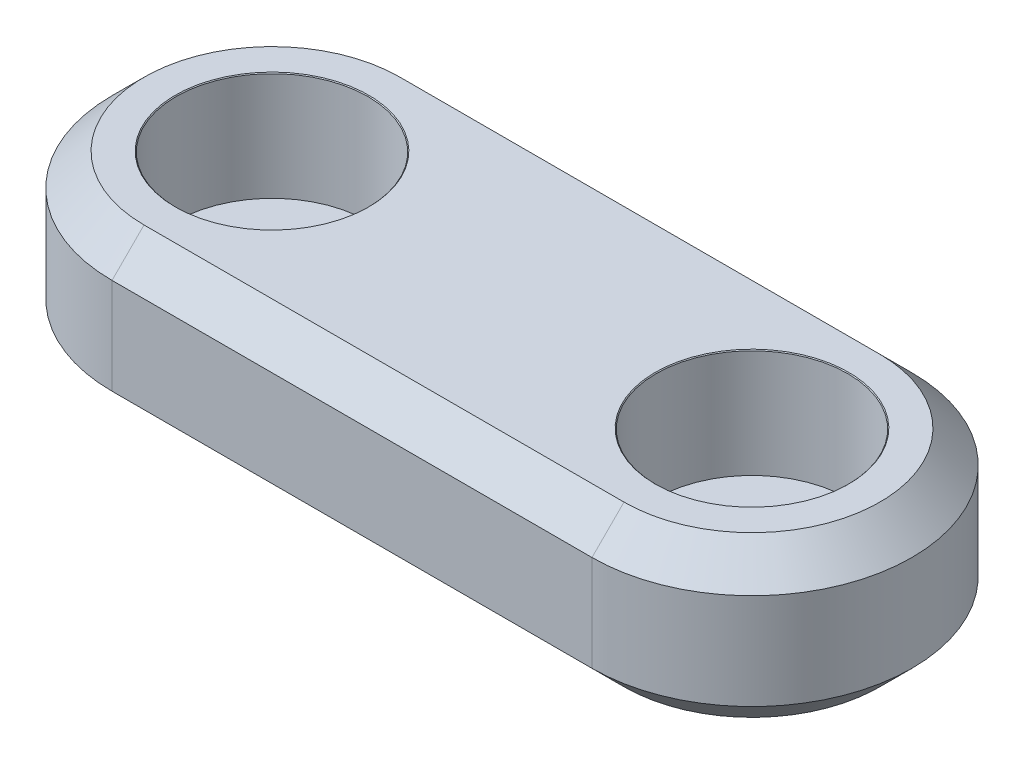
from build123d import *

# Parameters (mm, degrees)
BOSS_EXTRUDE1_DEPTH                          = 5
CBORE_FOR_M3_HEXAGON_SOCKET_HEAD_CAP_2_COUNT = 2
CBORE_FOR_M3_HEXAGON_SOCKET_HEAD_CAP_2_PITCH = 15
CHAMFER1_SIZE                                = 1


with BuildPart() as part:
    # Sketch1 → Boss-Extrude1 (new body)
    with BuildSketch(Plane(origin=(0, 0, 0), x_dir=(1, 0, 0), z_dir=(0, 1, 0))):
        with BuildLine():
            Line((-7.5, 5), (7.5, 5))
            ThreePointArc((7.5, 5), (12.5, 0), (7.5, -5))
            Line((7.5, -5), (-7.5, -5))
            ThreePointArc((-7.5, -5), (-12.5, 0), (-7.5, 5))
        make_face()
    extrude(amount=BOSS_EXTRUDE1_DEPTH)

    # Sketch3 → CBORE for M3 Hexagon socket head cap screws1 (revolve, cut)
    with BuildSketch(Plane(origin=(-7.5, 5, 0), x_dir=(0, 0, 1), z_dir=(1, 0, 0))):
        Polygon((0, 0), (0, 5), (1.6, 5), (1.6, 3.4), (3, 3.4), (3, 0.025), (3.025, 0), align=None)
    cbore_for_m3_hexagon_socket_head_cap_scr = revolve(axis=Axis((-7.5, 11.35, 0), (0, -1, 0)), mode=Mode.SUBTRACT)

    # CBORE for M3 Hexagon socket head cap 2: CBORE for M3 Hexagon socket head cap screws1 ×2
    with Locations(*[(i * CBORE_FOR_M3_HEXAGON_SOCKET_HEAD_CAP_2_PITCH, 0, 0) for i in range(1, CBORE_FOR_M3_HEXAGON_SOCKET_HEAD_CAP_2_COUNT)]):
        add(cbore_for_m3_hexagon_socket_head_cap_scr, mode=Mode.SUBTRACT)

    # Chamfer1
    chamfer1_edges = [part.edges().sort_by_distance(p)[0] for p in [
        (12.5, 5, 0),
        (0, 5, -5),
        (-12.5, 5, 0),
        (0, 0, -5),
        (12.5, 0, 0),
        (0, 0, 5),
        (-12.5, 0, 0),
        (0, 5, 5),
    ]]
    chamfer(chamfer1_edges, length=CHAMFER1_SIZE)


solid = part.part
